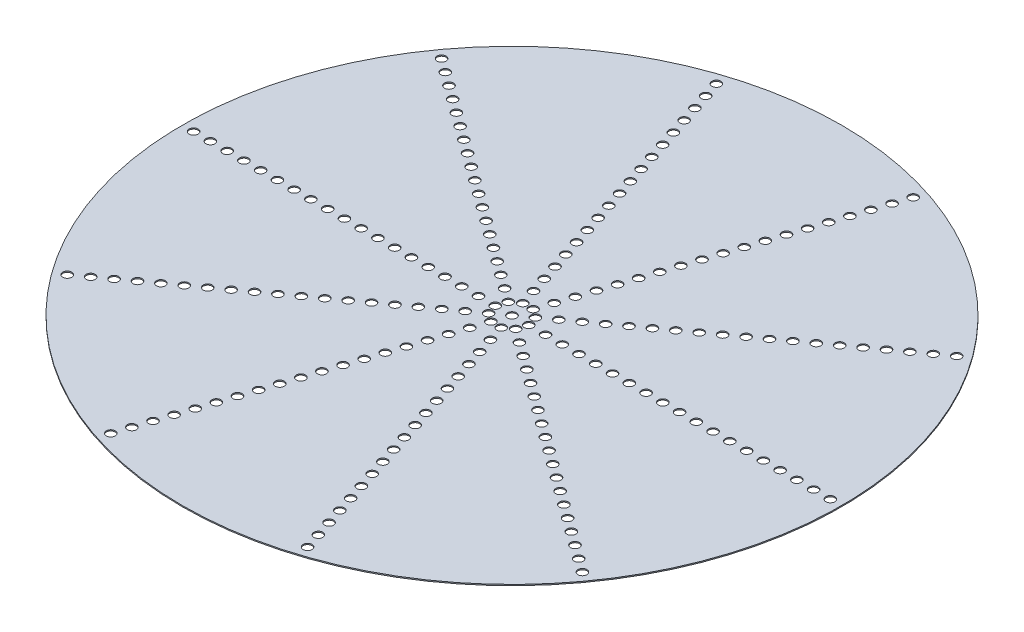
from build123d import *

# Parameters (mm, degrees)
CROQUIS1_R              = 29.5
SALIENTE_EXTRUIR1_DEPTH = 0.1
CROQUIS2_R              = 0.4
CORTAR_EXTRUIR1_DEPTH   = 42.719419938


with BuildPart() as part:
    # Croquis1 → Saliente-Extruir1 (new body)
    with BuildSketch(Plane(origin=(0, 0, 0), x_dir=(1, 0, 0), z_dir=(0, 1, 0))):
        with Locations(Location((0, 0, 0), (0, 0, 270))):
            Circle(CROQUIS1_R)
    extrude(amount=SALIENTE_EXTRUIR1_DEPTH)

    # Croquis2 → Cortar-Extruir1 (cut, through all)
    with BuildSketch(Plane(origin=(0, 0.1, 0), x_dir=(1, 0, 0), z_dir=(0, 1, 0))):
        with Locations(Location((0, 0, 0), (0, 0, 270))):
            Circle(CROQUIS2_R)
        with Locations(Location((1.5, 0, 0), (0, 0, 270))):
            Circle(CROQUIS2_R)
        with Locations(Location((3, 0, 0), (0, 0, 270))):
            Circle(CROQUIS2_R)
        with Locations(Location((4.5, 0, 0), (0, 0, 270))):
            Circle(CROQUIS2_R)
        with Locations(Location((6, 0, 0), (0, 0, 270))):
            Circle(CROQUIS2_R)
        with Locations(Location((7.5, 0, 0), (0, 0, 270))):
            Circle(CROQUIS2_R)
        with Locations(Location((9, 0, 0), (0, 0, 270))):
            Circle(CROQUIS2_R)
        with Locations(Location((10.5, 0, 0), (0, 0, 270))):
            Circle(CROQUIS2_R)
        with Locations(Location((12, 0, 0), (0, 0, 270))):
            Circle(CROQUIS2_R)
        with Locations(Location((13.5, 0, 0), (0, 0, 270))):
            Circle(CROQUIS2_R)
        with Locations(Location((15, 0, 0), (0, 0, 270))):
            Circle(CROQUIS2_R)
        with Locations(Location((16.5, 0, 0), (0, 0, 270))):
            Circle(CROQUIS2_R)
        with Locations(Location((18, 0, 0), (0, 0, 270))):
            Circle(CROQUIS2_R)
        with Locations(Location((19.5, 0, 0), (0, 0, 270))):
            Circle(CROQUIS2_R)
        with Locations(Location((21, 0, 0), (0, 0, 270))):
            Circle(CROQUIS2_R)
        with Locations(Location((22.5, 0, 0), (0, 0, 270))):
            Circle(CROQUIS2_R)
        with Locations(Location((24, 0, 0), (0, 0, 270))):
            Circle(CROQUIS2_R)
        with Locations(Location((25.5, 0, 0), (0, 0, 270))):
            Circle(CROQUIS2_R)
        with Locations(Location((27, 0, 0), (0, 0, 270))):
            Circle(CROQUIS2_R)
        with Locations(Location((28.5, 0, 0), (0, 0, 270))):
            Circle(CROQUIS2_R)
        with Locations(Location((1.213525492, -0.881677878, 0), (0, 0, 270))):
            Circle(CROQUIS2_R)
        with Locations(Location((2.427050983, -1.763355757, 0), (0, 0, 270))):
            Circle(CROQUIS2_R)
        with Locations(Location((3.640576475, -2.645033635, 0), (0, 0, 270))):
            Circle(CROQUIS2_R)
        with Locations(Location((4.854101966, -3.526711514, 0), (0, 0, 270))):
            Circle(CROQUIS2_R)
        with Locations(Location((6.067627458, -4.408389392, 0), (0, 0, 270))):
            Circle(CROQUIS2_R)
        with Locations(Location((7.281152949, -5.290067271, 0), (0, 0, 270))):
            Circle(CROQUIS2_R)
        with Locations(Location((8.494678441, -6.171745149, 0), (0, 0, 270))):
            Circle(CROQUIS2_R)
        with Locations(Location((9.708203932, -7.053423028, 0), (0, 0, 270))):
            Circle(CROQUIS2_R)
        with Locations(Location((10.921729424, -7.935100906, 0), (0, 0, 270))):
            Circle(CROQUIS2_R)
        with Locations(Location((12.135254916, -8.816778784, 0), (0, 0, 270))):
            Circle(CROQUIS2_R)
        with Locations(Location((13.348780407, -9.698456663, 0), (0, 0, 270))):
            Circle(CROQUIS2_R)
        with Locations(Location((14.562305899, -10.580134541, 0), (0, 0, 270))):
            Circle(CROQUIS2_R)
        with Locations(Location((15.77583139, -11.46181242, 0), (0, 0, 270))):
            Circle(CROQUIS2_R)
        with Locations(Location((16.989356882, -12.343490298, 0), (0, 0, 270))):
            Circle(CROQUIS2_R)
        with Locations(Location((18.202882373, -13.225168177, 0), (0, 0, 270))):
            Circle(CROQUIS2_R)
        with Locations(Location((19.416407865, -14.106846055, 0), (0, 0, 270))):
            Circle(CROQUIS2_R)
        with Locations(Location((20.629933357, -14.988523933, 0), (0, 0, 270))):
            Circle(CROQUIS2_R)
        with Locations(Location((21.843458848, -15.870201812, 0), (0, 0, 270))):
            Circle(CROQUIS2_R)
        with Locations(Location((23.05698434, -16.75187969, 0), (0, 0, 270))):
            Circle(CROQUIS2_R)
        with Locations(Location((0.463525492, -1.426584774, 0), (0, 0, 270))):
            Circle(CROQUIS2_R)
        with Locations(Location((0.927050983, -2.853169549, 0), (0, 0, 270))):
            Circle(CROQUIS2_R)
        with Locations(Location((1.390576475, -4.279754323, 0), (0, 0, 270))):
            Circle(CROQUIS2_R)
        with Locations(Location((1.854101966, -5.706339098, 0), (0, 0, 270))):
            Circle(CROQUIS2_R)
        with Locations(Location((2.317627458, -7.132923872, 0), (0, 0, 270))):
            Circle(CROQUIS2_R)
        with Locations(Location((2.781152949, -8.559508647, 0), (0, 0, 270))):
            Circle(CROQUIS2_R)
        with Locations(Location((3.244678441, -9.986093421, 0), (0, 0, 270))):
            Circle(CROQUIS2_R)
        with Locations(Location((3.708203932, -11.412678196, 0), (0, 0, 270))):
            Circle(CROQUIS2_R)
        with Locations(Location((4.171729424, -12.83926297, 0), (0, 0, 270))):
            Circle(CROQUIS2_R)
        with Locations(Location((4.635254916, -14.265847744, 0), (0, 0, 270))):
            Circle(CROQUIS2_R)
        with Locations(Location((5.098780407, -15.692432519, 0), (0, 0, 270))):
            Circle(CROQUIS2_R)
        with Locations(Location((5.562305899, -17.119017293, 0), (0, 0, 270))):
            Circle(CROQUIS2_R)
        with Locations(Location((6.02583139, -18.545602068, 0), (0, 0, 270))):
            Circle(CROQUIS2_R)
        with Locations(Location((6.489356882, -19.972186842, 0), (0, 0, 270))):
            Circle(CROQUIS2_R)
        with Locations(Location((6.952882373, -21.398771617, 0), (0, 0, 270))):
            Circle(CROQUIS2_R)
        with Locations(Location((7.416407865, -22.825356391, 0), (0, 0, 270))):
            Circle(CROQUIS2_R)
        with Locations(Location((7.879933357, -24.251941166, 0), (0, 0, 270))):
            Circle(CROQUIS2_R)
        with Locations(Location((8.343458848, -25.67852594, 0), (0, 0, 270))):
            Circle(CROQUIS2_R)
        with Locations(Location((8.80698434, -27.105110714, 0), (0, 0, 270))):
            Circle(CROQUIS2_R)
        with Locations(Location((-0.463525492, -1.426584774, 0), (0, 0, 270))):
            Circle(CROQUIS2_R)
        with Locations(Location((-0.927050983, -2.853169549, 0), (0, 0, 270))):
            Circle(CROQUIS2_R)
        with Locations(Location((-1.390576475, -4.279754323, 0), (0, 0, 270))):
            Circle(CROQUIS2_R)
        with Locations(Location((-1.854101966, -5.706339098, 0), (0, 0, 270))):
            Circle(CROQUIS2_R)
        with Locations(Location((-2.317627458, -7.132923872, 0), (0, 0, 270))):
            Circle(CROQUIS2_R)
        with Locations(Location((-2.781152949, -8.559508647, 0), (0, 0, 270))):
            Circle(CROQUIS2_R)
        with Locations(Location((-3.244678441, -9.986093421, 0), (0, 0, 270))):
            Circle(CROQUIS2_R)
        with Locations(Location((-3.708203932, -11.412678196, 0), (0, 0, 270))):
            Circle(CROQUIS2_R)
        with Locations(Location((-4.171729424, -12.83926297, 0), (0, 0, 270))):
            Circle(CROQUIS2_R)
        with Locations(Location((-4.635254916, -14.265847744, 0), (0, 0, 270))):
            Circle(CROQUIS2_R)
        with Locations(Location((-5.098780407, -15.692432519, 0), (0, 0, 270))):
            Circle(CROQUIS2_R)
        with Locations(Location((-5.562305899, -17.119017293, 0), (0, 0, 270))):
            Circle(CROQUIS2_R)
        with Locations(Location((-6.02583139, -18.545602068, 0), (0, 0, 270))):
            Circle(CROQUIS2_R)
        with Locations(Location((-6.489356882, -19.972186842, 0), (0, 0, 270))):
            Circle(CROQUIS2_R)
        with Locations(Location((-6.952882373, -21.398771617, 0), (0, 0, 270))):
            Circle(CROQUIS2_R)
        with Locations(Location((-7.416407865, -22.825356391, 0), (0, 0, 270))):
            Circle(CROQUIS2_R)
        with Locations(Location((-7.879933357, -24.251941166, 0), (0, 0, 270))):
            Circle(CROQUIS2_R)
        with Locations(Location((-8.343458848, -25.67852594, 0), (0, 0, 270))):
            Circle(CROQUIS2_R)
        with Locations(Location((-8.80698434, -27.105110714, 0), (0, 0, 270))):
            Circle(CROQUIS2_R)
        with Locations(Location((-1.213525492, -0.881677878, 0), (0, 0, 270))):
            Circle(CROQUIS2_R)
        with Locations(Location((-2.427050983, -1.763355757, 0), (0, 0, 270))):
            Circle(CROQUIS2_R)
        with Locations(Location((-3.640576475, -2.645033635, 0), (0, 0, 270))):
            Circle(CROQUIS2_R)
        with Locations(Location((-4.854101966, -3.526711514, 0), (0, 0, 270))):
            Circle(CROQUIS2_R)
        with Locations(Location((-6.067627458, -4.408389392, 0), (0, 0, 270))):
            Circle(CROQUIS2_R)
        with Locations(Location((-7.281152949, -5.290067271, 0), (0, 0, 270))):
            Circle(CROQUIS2_R)
        with Locations(Location((-8.494678441, -6.171745149, 0), (0, 0, 270))):
            Circle(CROQUIS2_R)
        with Locations(Location((-9.708203932, -7.053423028, 0), (0, 0, 270))):
            Circle(CROQUIS2_R)
        with Locations(Location((-10.921729424, -7.935100906, 0), (0, 0, 270))):
            Circle(CROQUIS2_R)
        with Locations(Location((-12.135254916, -8.816778784, 0), (0, 0, 270))):
            Circle(CROQUIS2_R)
        with Locations(Location((-13.348780407, -9.698456663, 0), (0, 0, 270))):
            Circle(CROQUIS2_R)
        with Locations(Location((-14.562305899, -10.580134541, 0), (0, 0, 270))):
            Circle(CROQUIS2_R)
        with Locations(Location((-15.77583139, -11.46181242, 0), (0, 0, 270))):
            Circle(CROQUIS2_R)
        with Locations(Location((-16.989356882, -12.343490298, 0), (0, 0, 270))):
            Circle(CROQUIS2_R)
        with Locations(Location((-18.202882373, -13.225168177, 0), (0, 0, 270))):
            Circle(CROQUIS2_R)
        with Locations(Location((-19.416407865, -14.106846055, 0), (0, 0, 270))):
            Circle(CROQUIS2_R)
        with Locations(Location((-20.629933357, -14.988523933, 0), (0, 0, 270))):
            Circle(CROQUIS2_R)
        with Locations(Location((-21.843458848, -15.870201812, 0), (0, 0, 270))):
            Circle(CROQUIS2_R)
        with Locations(Location((-23.05698434, -16.75187969, 0), (0, 0, 270))):
            Circle(CROQUIS2_R)
        with Locations(Location((-1.5, 0, 0), (0, 0, 270))):
            Circle(CROQUIS2_R)
        with Locations(Location((-3, 0, 0), (0, 0, 270))):
            Circle(CROQUIS2_R)
        with Locations(Location((-4.5, 0, 0), (0, 0, 270))):
            Circle(CROQUIS2_R)
        with Locations(Location((-6, 0, 0), (0, 0, 270))):
            Circle(CROQUIS2_R)
        with Locations(Location((-7.5, 0, 0), (0, 0, 270))):
            Circle(CROQUIS2_R)
        with Locations(Location((-9, 0, 0), (0, 0, 270))):
            Circle(CROQUIS2_R)
        with Locations(Location((-10.5, 0, 0), (0, 0, 270))):
            Circle(CROQUIS2_R)
        with Locations(Location((-12, 0, 0), (0, 0, 270))):
            Circle(CROQUIS2_R)
        with Locations(Location((-13.5, 0, 0), (0, 0, 270))):
            Circle(CROQUIS2_R)
        with Locations(Location((-15, 0, 0), (0, 0, 270))):
            Circle(CROQUIS2_R)
        with Locations(Location((-16.5, 0, 0), (0, 0, 270))):
            Circle(CROQUIS2_R)
        with Locations(Location((-18, 0, 0), (0, 0, 270))):
            Circle(CROQUIS2_R)
        with Locations(Location((-19.5, 0, 0), (0, 0, 270))):
            Circle(CROQUIS2_R)
        with Locations(Location((-21, 0, 0), (0, 0, 270))):
            Circle(CROQUIS2_R)
        with Locations(Location((-22.5, 0, 0), (0, 0, 270))):
            Circle(CROQUIS2_R)
        with Locations(Location((-24, 0, 0), (0, 0, 270))):
            Circle(CROQUIS2_R)
        with Locations(Location((-25.5, 0, 0), (0, 0, 270))):
            Circle(CROQUIS2_R)
        with Locations(Location((-27, 0, 0), (0, 0, 270))):
            Circle(CROQUIS2_R)
        with Locations(Location((-28.5, 0, 0), (0, 0, 270))):
            Circle(CROQUIS2_R)
        with Locations(Location((-1.213525492, 0.881677878, 0), (0, 0, 270))):
            Circle(CROQUIS2_R)
        with Locations(Location((-2.427050983, 1.763355757, 0), (0, 0, 270))):
            Circle(CROQUIS2_R)
        with Locations(Location((-3.640576475, 2.645033635, 0), (0, 0, 270))):
            Circle(CROQUIS2_R)
        with Locations(Location((-4.854101966, 3.526711514, 0), (0, 0, 270))):
            Circle(CROQUIS2_R)
        with Locations(Location((-6.067627458, 4.408389392, 0), (0, 0, 270))):
            Circle(CROQUIS2_R)
        with Locations(Location((-7.281152949, 5.290067271, 0), (0, 0, 270))):
            Circle(CROQUIS2_R)
        with Locations(Location((-8.494678441, 6.171745149, 0), (0, 0, 270))):
            Circle(CROQUIS2_R)
        with Locations(Location((-9.708203932, 7.053423028, 0), (0, 0, 270))):
            Circle(CROQUIS2_R)
        with Locations(Location((-10.921729424, 7.935100906, 0), (0, 0, 270))):
            Circle(CROQUIS2_R)
        with Locations(Location((-12.135254916, 8.816778784, 0), (0, 0, 270))):
            Circle(CROQUIS2_R)
        with Locations(Location((-13.348780407, 9.698456663, 0), (0, 0, 270))):
            Circle(CROQUIS2_R)
        with Locations(Location((-14.562305899, 10.580134541, 0), (0, 0, 270))):
            Circle(CROQUIS2_R)
        with Locations(Location((-15.77583139, 11.46181242, 0), (0, 0, 270))):
            Circle(CROQUIS2_R)
        with Locations(Location((-16.989356882, 12.343490298, 0), (0, 0, 270))):
            Circle(CROQUIS2_R)
        with Locations(Location((-18.202882373, 13.225168177, 0), (0, 0, 270))):
            Circle(CROQUIS2_R)
        with Locations(Location((-19.416407865, 14.106846055, 0), (0, 0, 270))):
            Circle(CROQUIS2_R)
        with Locations(Location((-20.629933357, 14.988523933, 0), (0, 0, 270))):
            Circle(CROQUIS2_R)
        with Locations(Location((-21.843458848, 15.870201812, 0), (0, 0, 270))):
            Circle(CROQUIS2_R)
        with Locations(Location((-23.05698434, 16.75187969, 0), (0, 0, 270))):
            Circle(CROQUIS2_R)
        with Locations(Location((-0.463525492, 1.426584774, 0), (0, 0, 270))):
            Circle(CROQUIS2_R)
        with Locations(Location((-0.927050983, 2.853169549, 0), (0, 0, 270))):
            Circle(CROQUIS2_R)
        with Locations(Location((-1.390576475, 4.279754323, 0), (0, 0, 270))):
            Circle(CROQUIS2_R)
        with Locations(Location((-1.854101966, 5.706339098, 0), (0, 0, 270))):
            Circle(CROQUIS2_R)
        with Locations(Location((-2.317627458, 7.132923872, 0), (0, 0, 270))):
            Circle(CROQUIS2_R)
        with Locations(Location((-2.781152949, 8.559508647, 0), (0, 0, 270))):
            Circle(CROQUIS2_R)
        with Locations(Location((-3.244678441, 9.986093421, 0), (0, 0, 270))):
            Circle(CROQUIS2_R)
        with Locations(Location((-3.708203932, 11.412678196, 0), (0, 0, 270))):
            Circle(CROQUIS2_R)
        with Locations(Location((-4.171729424, 12.83926297, 0), (0, 0, 270))):
            Circle(CROQUIS2_R)
        with Locations(Location((-4.635254916, 14.265847744, 0), (0, 0, 270))):
            Circle(CROQUIS2_R)
        with Locations(Location((-5.098780407, 15.692432519, 0), (0, 0, 270))):
            Circle(CROQUIS2_R)
        with Locations(Location((-5.562305899, 17.119017293, 0), (0, 0, 270))):
            Circle(CROQUIS2_R)
        with Locations(Location((-6.02583139, 18.545602068, 0), (0, 0, 270))):
            Circle(CROQUIS2_R)
        with Locations(Location((-6.489356882, 19.972186842, 0), (0, 0, 270))):
            Circle(CROQUIS2_R)
        with Locations(Location((-6.952882373, 21.398771617, 0), (0, 0, 270))):
            Circle(CROQUIS2_R)
        with Locations(Location((-7.416407865, 22.825356391, 0), (0, 0, 270))):
            Circle(CROQUIS2_R)
        with Locations(Location((-7.879933357, 24.251941166, 0), (0, 0, 270))):
            Circle(CROQUIS2_R)
        with Locations(Location((-8.343458848, 25.67852594, 0), (0, 0, 270))):
            Circle(CROQUIS2_R)
        with Locations(Location((-8.80698434, 27.105110714, 0), (0, 0, 270))):
            Circle(CROQUIS2_R)
        with Locations(Location((0.463525492, 1.426584774, 0), (0, 0, 270))):
            Circle(CROQUIS2_R)
        with Locations(Location((0.927050983, 2.853169549, 0), (0, 0, 270))):
            Circle(CROQUIS2_R)
        with Locations(Location((1.390576475, 4.279754323, 0), (0, 0, 270))):
            Circle(CROQUIS2_R)
        with Locations(Location((1.854101966, 5.706339098, 0), (0, 0, 270))):
            Circle(CROQUIS2_R)
        with Locations(Location((2.317627458, 7.132923872, 0), (0, 0, 270))):
            Circle(CROQUIS2_R)
        with Locations(Location((2.781152949, 8.559508647, 0), (0, 0, 270))):
            Circle(CROQUIS2_R)
        with Locations(Location((3.244678441, 9.986093421, 0), (0, 0, 270))):
            Circle(CROQUIS2_R)
        with Locations(Location((3.708203932, 11.412678196, 0), (0, 0, 270))):
            Circle(CROQUIS2_R)
        with Locations(Location((4.171729424, 12.83926297, 0), (0, 0, 270))):
            Circle(CROQUIS2_R)
        with Locations(Location((4.635254916, 14.265847744, 0), (0, 0, 270))):
            Circle(CROQUIS2_R)
        with Locations(Location((5.098780407, 15.692432519, 0), (0, 0, 270))):
            Circle(CROQUIS2_R)
        with Locations(Location((5.562305899, 17.119017293, 0), (0, 0, 270))):
            Circle(CROQUIS2_R)
        with Locations(Location((6.02583139, 18.545602068, 0), (0, 0, 270))):
            Circle(CROQUIS2_R)
        with Locations(Location((6.489356882, 19.972186842, 0), (0, 0, 270))):
            Circle(CROQUIS2_R)
        with Locations(Location((6.952882373, 21.398771617, 0), (0, 0, 270))):
            Circle(CROQUIS2_R)
        with Locations(Location((7.416407865, 22.825356391, 0), (0, 0, 270))):
            Circle(CROQUIS2_R)
        with Locations(Location((7.879933357, 24.251941166, 0), (0, 0, 270))):
            Circle(CROQUIS2_R)
        with Locations(Location((8.343458848, 25.67852594, 0), (0, 0, 270))):
            Circle(CROQUIS2_R)
        with Locations(Location((8.80698434, 27.105110714, 0), (0, 0, 270))):
            Circle(CROQUIS2_R)
        with Locations(Location((1.213525492, 0.881677878, 0), (0, 0, 270))):
            Circle(CROQUIS2_R)
        with Locations(Location((2.427050983, 1.763355757, 0), (0, 0, 270))):
            Circle(CROQUIS2_R)
        with Locations(Location((3.640576475, 2.645033635, 0), (0, 0, 270))):
            Circle(CROQUIS2_R)
        with Locations(Location((4.854101966, 3.526711514, 0), (0, 0, 270))):
            Circle(CROQUIS2_R)
        with Locations(Location((6.067627458, 4.408389392, 0), (0, 0, 270))):
            Circle(CROQUIS2_R)
        with Locations(Location((7.281152949, 5.290067271, 0), (0, 0, 270))):
            Circle(CROQUIS2_R)
        with Locations(Location((8.494678441, 6.171745149, 0), (0, 0, 270))):
            Circle(CROQUIS2_R)
        with Locations(Location((9.708203932, 7.053423028, 0), (0, 0, 270))):
            Circle(CROQUIS2_R)
        with Locations(Location((10.921729424, 7.935100906, 0), (0, 0, 270))):
            Circle(CROQUIS2_R)
        with Locations(Location((12.135254916, 8.816778784, 0), (0, 0, 270))):
            Circle(CROQUIS2_R)
        with Locations(Location((13.348780407, 9.698456663, 0), (0, 0, 270))):
            Circle(CROQUIS2_R)
        with Locations(Location((14.562305899, 10.580134541, 0), (0, 0, 270))):
            Circle(CROQUIS2_R)
        with Locations(Location((15.77583139, 11.46181242, 0), (0, 0, 270))):
            Circle(CROQUIS2_R)
        with Locations(Location((16.989356882, 12.343490298, 0), (0, 0, 270))):
            Circle(CROQUIS2_R)
        with Locations(Location((18.202882373, 13.225168177, 0), (0, 0, 270))):
            Circle(CROQUIS2_R)
        with Locations(Location((19.416407865, 14.106846055, 0), (0, 0, 270))):
            Circle(CROQUIS2_R)
        with Locations(Location((20.629933357, 14.988523933, 0), (0, 0, 270))):
            Circle(CROQUIS2_R)
        with Locations(Location((21.843458848, 15.870201812, 0), (0, 0, 270))):
            Circle(CROQUIS2_R)
        with Locations(Location((23.05698434, 16.75187969, 0), (0, 0, 270))):
            Circle(CROQUIS2_R)
    extrude(amount=-CORTAR_EXTRUIR1_DEPTH, mode=Mode.SUBTRACT)


solid = part.part
